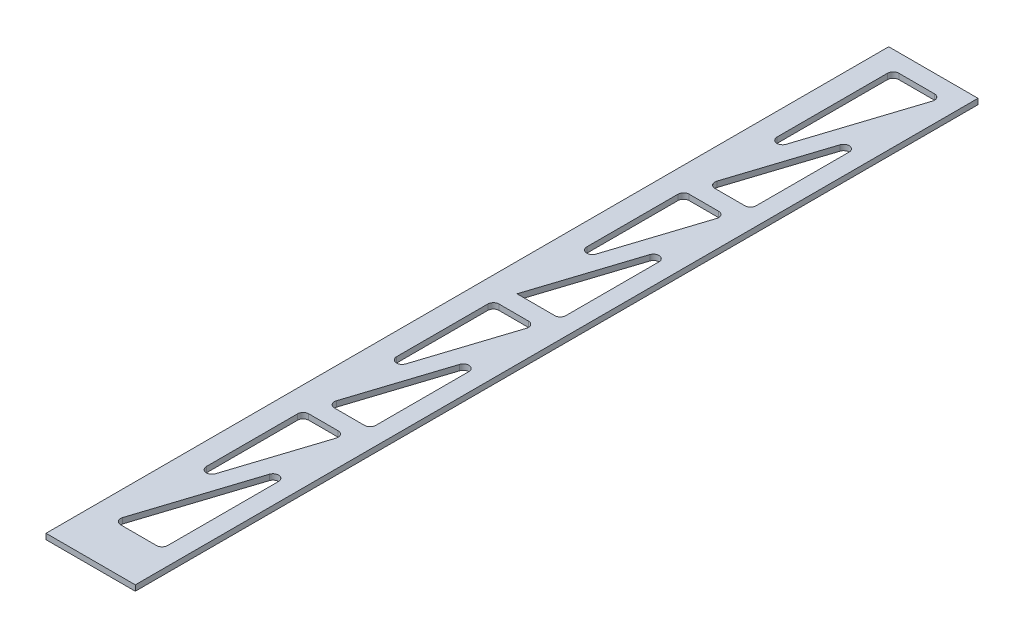
from build123d import *

# Parameters (mm, degrees)
SKETCH1_W           = 25.4
SKETCH1_H           = 239.7125
BOSS_EXTRUDE1_DEPTH = 1.5875
CUT_EXTRUDE1_DEPTH  = 1.5875


with BuildPart() as part:
    # Sketch1 → Boss-Extrude1 (new body)
    with BuildSketch(Plane(origin=(0, 0, 0), x_dir=(1, 0, 0), z_dir=(0, 1, 0))):
        Rectangle(SKETCH1_W, SKETCH1_H)
    extrude(amount=BOSS_EXTRUDE1_DEPTH)

    # Sketch2 → Cut-Extrude1 (cut)
    with BuildSketch(Plane(origin=(0, 1.5875, 0), x_dir=(1, 0, 0), z_dir=(0, 1, 0))):
        with BuildLine():
            Line((-4.168311679, -107.15625), (6.0325, -107.15625))
            ThreePointArc((6.0325, -107.15625), (7.155032015, -106.691282015), (7.62, -105.56875))
            Line((7.62, -105.56875), (7.62, -74.018760533))
            ThreePointArc((7.62, -74.018760533), (6.279706302, -72.450626198), (4.521990181, -73.530379191))
            Line((4.521990181, -73.530379191), (-5.678821499, -105.080368658))
            ThreePointArc((-5.678821499, -105.080368658), (-5.451951355, -106.50278717), (-4.168311679, -107.15625))
        make_face()
        with BuildLine():
            Line((-4.7625, 114.77625), (5.407956322, 114.77625))
            ThreePointArc((5.407956322, 114.77625), (6.691595997, 114.12278717), (6.918466141, 112.700368658))
            Line((6.918466141, 112.700368658), (-3.251990181, 81.244264977))
            ThreePointArc((-3.251990181, 81.244264977), (-5.009706302, 80.164511984), (-6.35, 81.732646319))
            Line((-6.35, 81.732646319), (-6.35, 113.18875))
            ThreePointArc((-6.35, 113.18875), (-5.885032015, 114.311282015), (-4.7625, 114.77625))
        make_face()
        with BuildLine():
            Line((7.62, 88.287239467), (7.62, 61.81725))
            ThreePointArc((7.62, 61.81725), (7.155032015, 60.694717985), (6.0325, 60.22975))
            Line((6.0325, 60.22975), (-2.525834956, 60.22975))
            ThreePointArc((-2.525834956, 60.22975), (-3.809474631, 60.88321283), (-4.036344775, 62.305631342))
            Line((-4.036344775, 62.305631342), (4.521990181, 88.775620809))
            ThreePointArc((4.521990181, 88.775620809), (6.279706302, 89.855373802), (7.62, 88.287239467))
        make_face()
        with BuildLine():
            Line((-3.251990181, -81.061735023), (5.132272704, -55.130131342))
            ThreePointArc((5.132272704, -55.130131342), (4.90540256, -53.70771283), (3.621762885, -53.05425))
            Line((3.621762885, -53.05425), (-4.7625, -53.05425))
            ThreePointArc((-4.7625, -53.05425), (-5.885032015, -53.519217985), (-6.35, -54.64175))
            Line((-6.35, -54.64175), (-6.35, -80.573353681))
            ThreePointArc((-6.35, -80.573353681), (-5.009706302, -82.141488016), (-3.251990181, -81.061735023))
        make_face()
        with BuildLine():
            Line((-3.251990181, -26.959735023), (5.132272704, -1.028131342))
            ThreePointArc((5.132272704, -1.028131342), (4.90540256, 0.39428717), (3.621762885, 1.04775))
            Line((3.621762885, 1.04775), (-4.7625, 1.04775))
            ThreePointArc((-4.7625, 1.04775), (-5.885032015, 0.582782015), (-6.35, -0.53975))
            Line((-6.35, -0.53975), (-6.35, -26.471353681))
            ThreePointArc((-6.35, -26.471353681), (-5.009706302, -28.039488016), (-3.251990181, -26.959735023))
        make_face()
        with BuildLine():
            Line((-4.036344775, -45.898368658), (4.521990181, -19.428379191))
            ThreePointArc((4.521990181, -19.428379191), (6.279706302, -18.348626198), (7.62, -19.916760533))
            Line((7.62, -19.916760533), (7.62, -46.38675))
            ThreePointArc((7.62, -46.38675), (7.155032015, -47.509282015), (6.0325, -47.97425))
            Line((6.0325, -47.97425), (-2.525834956, -47.97425))
            ThreePointArc((-2.525834956, -47.97425), (-3.809474631, -47.32078717), (-4.036344775, -45.898368658))
        make_face()
        with BuildLine():
            Line((-3.251990181, 27.142264977), (5.132272704, 53.073868658))
            ThreePointArc((5.132272704, 53.073868658), (4.90540256, 54.49628717), (3.621762885, 55.14975))
            Line((3.621762885, 55.14975), (-4.7625, 55.14975))
            ThreePointArc((-4.7625, 55.14975), (-5.885032015, 54.684782015), (-6.35, 53.56225))
            Line((-6.35, 53.56225), (-6.35, 27.630646319))
            ThreePointArc((-6.35, 27.630646319), (-5.009706302, 26.062511984), (-3.251990181, 27.142264977))
        make_face()
        with BuildLine():
            Line((-4.707523276, 6.12775), (4.521990181, 34.673620809))
            ThreePointArc((4.521990181, 34.673620809), (6.279706302, 35.753373802), (7.62, 34.185239467))
            Line((7.62, 34.185239467), (7.62, 7.71525))
            ThreePointArc((7.62, 7.71525), (7.155032015, 6.592717985), (6.0325, 6.12775))
            Line((6.0325, 6.12775), (-4.707523276, 6.12775))
        make_face()
    extrude(amount=-CUT_EXTRUDE1_DEPTH, mode=Mode.SUBTRACT)


solid = part.part
